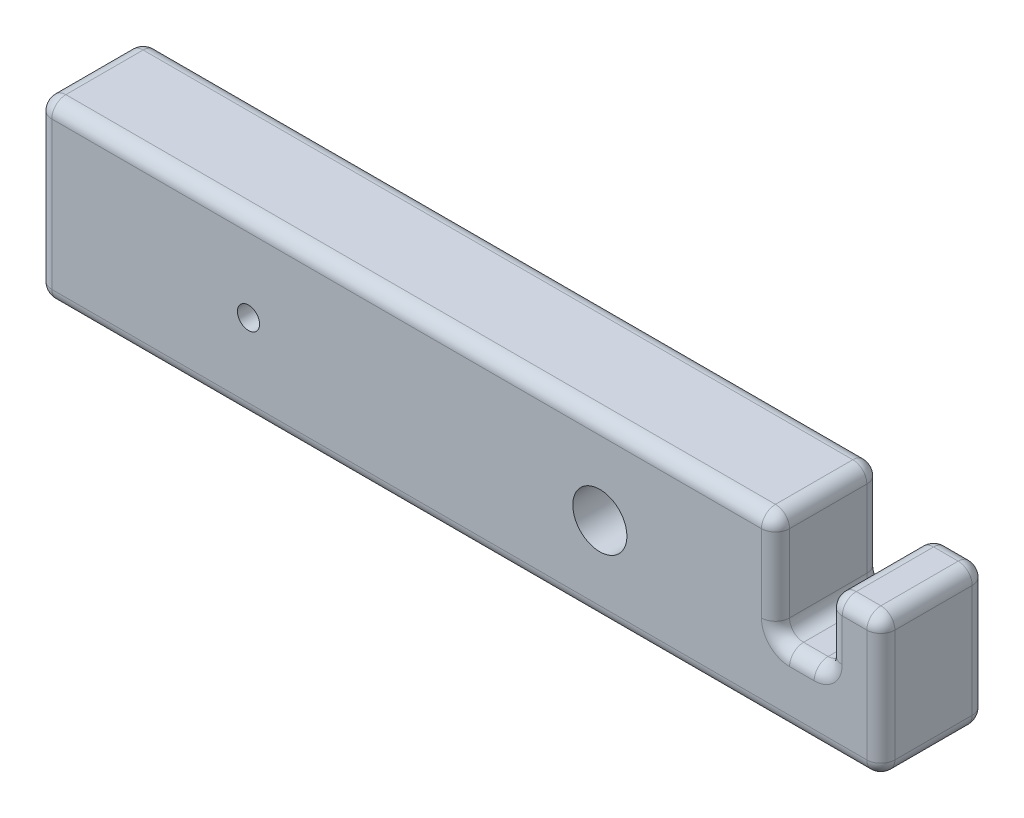
from build123d import *

# Parameters (mm, degrees)
BOSS_EXTRUDE1_DEPTH = 19.05
FILLET2_R           = 2.54


with BuildPart() as part:
    # Sketch1 → Boss-Extrude1 (new body)
    with BuildSketch(Plane.XY):
        with BuildLine():
            ThreePointArc((101.6, 10.9855), (96.7105, 15.875), (101.6, 20.7645))
            Line((101.6, 20.7645), (101.6, 31.75))
            Line((101.6, 31.75), (38.1, 31.75))
            Line((38.1, 31.75), (38.1, 17.875))
            ThreePointArc((38.1, 17.875), (39.514213562, 17.289213562), (40.1, 15.875))
            ThreePointArc((40.1, 15.875), (39.514213562, 14.460786438), (38.1, 13.875))
            Line((38.1, 13.875), (38.1, 0))
            Line((38.1, 0), (101.6, 0))
            Line((101.6, 0), (101.6, 10.9855))
        make_face()
        with BuildLine():
            Line((101.6, 31.75), (101.6, 20.7645))
            ThreePointArc((101.6, 20.7645), (105.057398607, 19.332398607), (106.4895, 15.875))
            ThreePointArc((106.4895, 15.875), (105.057398607, 12.417601393), (101.6, 10.9855))
            Line((101.6, 10.9855), (101.6, 0))
            Line((101.6, 0), (152.4, 0))
            Line((152.4, 0), (152.4, 25.4))
            Line((152.4, 25.4), (142.875, 25.4))
            Line((142.875, 25.4), (142.875, 12.7))
            Line((142.875, 12.7), (133.35, 12.7))
            Line((133.35, 12.7), (133.35, 31.75))
            Line((133.35, 31.75), (101.6, 31.75))
        make_face()
        with BuildLine():
            Line((38.1, 17.875), (38.1, 31.75))
            Line((38.1, 31.75), (0, 31.75))
            Line((0, 31.75), (0, 0))
            Line((0, 0), (38.1, 0))
            Line((38.1, 0), (38.1, 13.875))
            ThreePointArc((38.1, 13.875), (36.1, 15.875), (38.1, 17.875))
        make_face()
    extrude(amount=BOSS_EXTRUDE1_DEPTH)

    # Fillet2
    fillet2_edges = [part.edges().sort_by_distance(p)[0] for p in [
        (76.2, 0, 19.05),
        (66.675, 31.75, 0),
        (133.35, 22.225, 0),
        (138.1125, 12.7, 0),
        (142.875, 19.05, 0),
        (147.6375, 25.4, 0),
        (152.4, 12.7, 0),
        (152.4, 12.7, 19.05),
        (76.2, 0, 0),
        (0, 15.875, 0),
        (147.6375, 25.4, 19.05),
        (0, 31.75, 9.525),
        (133.35, 31.75, 9.525),
        (133.35, 12.7, 9.525),
        (142.875, 12.7, 9.525),
        (142.875, 25.4, 9.525),
        (152.4, 25.4, 9.525),
        (152.4, 0, 9.525),
        (0, 0, 9.525),
        (142.875, 19.05, 19.05),
        (138.1125, 12.7, 19.05),
        (133.35, 22.225, 19.05),
        (66.675, 31.75, 19.05),
        (0, 15.875, 19.05),
    ]]
    fillet(fillet2_edges, radius=FILLET2_R)


solid = part.part
